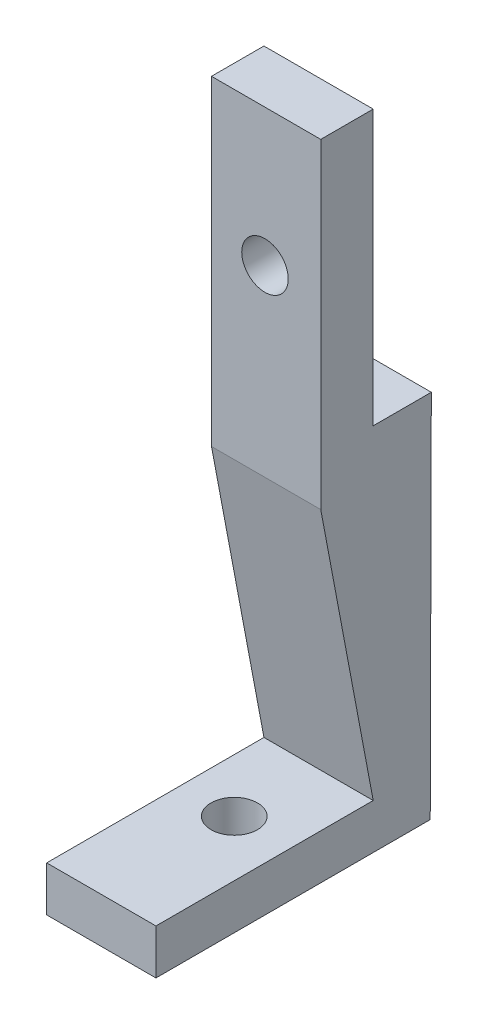
from build123d import *

# Parameters (mm, degrees)
BOSS_EXTRUDE1_DEPTH = 4.7
SKETCH2_R           = 1
CUT_EXTRUDE1_DEPTH  = 4.7
SKETCH3_R           = 1
CUT_EXTRUDE2_DEPTH  = 4.7


with BuildPart() as part:
    # Sketch1 → Boss-Extrude1 (new body)
    with BuildSketch(Plane(origin=(0, 0, 0), x_dir=(0, 0, -1), z_dir=(1, 0, 0))):
        Polygon((-2.453503476, 27.7), (-2.453503476, 15.9), (0.046496524, 15.9), (0, 0), (-11.8, 0), (-11.8, 1.939542533), (-2.453503476, 1.939542533), (-4.709766252, 13.909076926), (-4.709766252, 27.7), align=None)
    extrude(amount=BOSS_EXTRUDE1_DEPTH)

    # Sketch2 → Cut-Extrude1 (cut)
    with BuildSketch(Plane(origin=(0, 0, 2.453503476), x_dir=(-1, 0, 0), z_dir=(0, 0, -1))):
        with Locations(Location((-2.3, 21.8, 0), (0, 0, 90))):
            Circle(SKETCH2_R)
    extrude(amount=-CUT_EXTRUDE1_DEPTH, mode=Mode.SUBTRACT)

    # Sketch3 → Cut-Extrude2 (cut)
    with BuildSketch(Plane.XZ):
        with Locations(Location((2.3, 6.031025585, 0), (0, 0, 270))):
            Circle(SKETCH3_R)
    extrude(amount=-CUT_EXTRUDE2_DEPTH, mode=Mode.SUBTRACT)


solid = part.part
